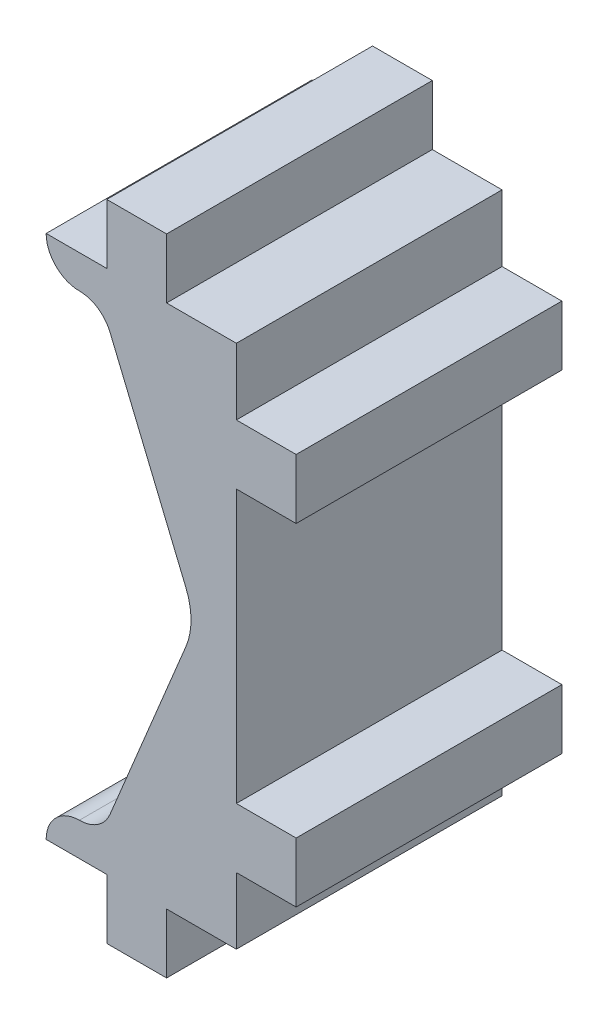
from build123d import *

# Parameters (mm, degrees)
P_IDAT_VYSUNUT_M1_DEPTH = 8
ZAOBLIT1_R              = 2


with BuildPart() as part:
    # Skica1 → Přidat vysunutím1 (new body)
    with BuildSketch(Plane.XY):
        with BuildLine():
            Line((1.2, 7.9), (1.2, 5.9))
            Line((1.2, 5.9), (3, 5.9))
            Line((3, 5.9), (3, 4.1))
            Line((3, 4.1), (1.2, 4.1))
            Line((1.2, 4.1), (1.2, -4.1))
            Line((1.2, -4.1), (3, -4.1))
            Line((3, -4.1), (3, -5.9))
            Line((3, -5.9), (1.2, -5.9))
            Line((1.2, -5.9), (1.2, -7.9))
            Line((1.2, -7.9), (-0.9, -7.9))
            Line((-0.9, -7.9), (-0.9, -9.7))
            Line((-0.9, -9.7), (-2.7, -9.7))
            Line((-2.7, -9.7), (-2.7, -7.9))
            Line((-2.7, -7.9), (-4.526252218, -7.9))
            ThreePointArc((-4.526252218, -7.9), (-4.233358999, -7.192893219), (-3.526252218, -6.9))
            ThreePointArc((-3.526252218, -6.9), (-2.970681985, -6.731469612), (-2.602372686, -6.282683432))
            Line((-2.602372686, -6.282683432), (0, 0))
            Line((0, 0), (-2.602372686, 6.282683432))
            ThreePointArc((-2.602372686, 6.282683432), (-2.970681985, 6.731469612), (-3.526252218, 6.9))
            ThreePointArc((-3.526252218, 6.9), (-4.233358999, 7.192893219), (-4.526252218, 7.9))
            Line((-4.526252218, 7.9), (-2.7, 7.9))
            Line((-2.7, 7.9), (-2.7, 9.7))
            Line((-2.7, 9.7), (-0.9, 9.7))
            Line((-0.9, 9.7), (-0.9, 7.9))
            Line((-0.9, 7.9), (1.2, 7.9))
        make_face()
    extrude(amount=P_IDAT_VYSUNUT_M1_DEPTH)

    # Zaoblit1
    zaoblit1_edges = [part.edges().sort_by_distance(p)[0] for p in [
        (0, 0, 4),
    ]]
    fillet(zaoblit1_edges, radius=ZAOBLIT1_R)


solid = part.part
